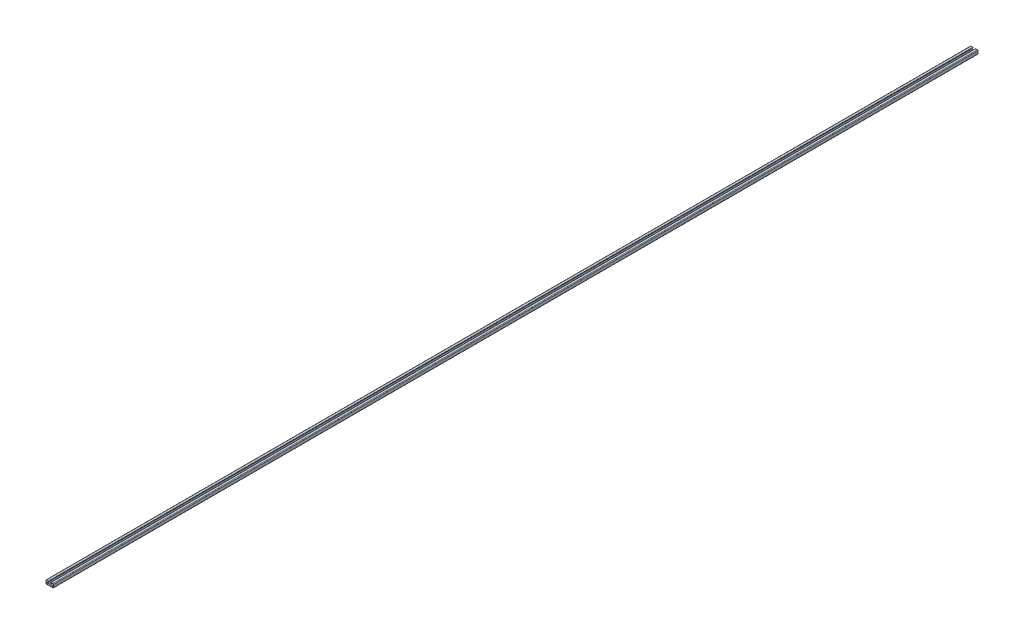
from build123d import *

# Parameters (mm, degrees)
SKETCH1_R           = 2
BOSS_EXTRUDE2_DEPTH = 3048
FILLET1_R           = 1.065
FILLET4_R           = 2.13
FILLET5_R           = 2.13
FILLET8_R           = 0.5325
FILLET11_R          = 0.5325
FILLET15_R          = 3
FILLET16_R          = 3


with BuildPart() as part:
    # Sketch1 → Boss-Extrude2 (new body)
    with BuildSketch(Plane.XY):
        Polygon((7.345, 3.97), (3.25, -1.87), (-3.25, -1.87), (-7.345, 3.97), (-3.25, 3.97), (-3.25, 6.25), (-12.5, 6.25), (-12.5, -6.25), (12.5, -6.25), (12.5, 6.25), (3.25, 6.25), (3.25, 3.97), align=None)
        with Locations((-8.5, -2.25)):
            Circle(SKETCH1_R, mode=Mode.SUBTRACT)
        with Locations((8.5, -2.25)):
            Circle(SKETCH1_R, mode=Mode.SUBTRACT)
    extrude(amount=BOSS_EXTRUDE2_DEPTH)

    # Fillet1
    fillet1_edges = [part.edges().sort_by_distance(p)[0] for p in [
        (3.25, 3.97, 1524),
        (3.25, 6.25, 1524),
        (-3.25, 6.25, 1524),
        (-3.25, 3.97, 1524),
    ]]
    fillet(fillet1_edges, radius=FILLET1_R)

    # Fillet4
    fillet4_edges = [part.edges().sort_by_distance(p)[0] for p in [
        (12.5, 6.25, 1524),
    ]]
    fillet(fillet4_edges, radius=FILLET4_R)

    # Fillet5
    fillet5_edges = [part.edges().sort_by_distance(p)[0] for p in [
        (12.5, -6.25, 1524),
        (-12.5, -6.25, 1524),
        (-12.5, 6.25, 1524),
    ]]
    fillet(fillet5_edges, radius=FILLET5_R)

    # Fillet8
    fillet8_edges = [part.edges().sort_by_distance(p)[0] for p in [
        (7.345, 3.97, 1524),
    ]]
    fillet(fillet8_edges, radius=FILLET8_R)

    # Fillet11
    fillet11_edges = [part.edges().sort_by_distance(p)[0] for p in [
        (-7.345, 3.97, 1524),
    ]]
    fillet(fillet11_edges, radius=FILLET11_R)

    # Fillet15
    fillet15_edges = [part.edges().sort_by_distance(p)[0] for p in [
        (-3.25, -1.87, 1524),
    ]]
    fillet(fillet15_edges, radius=FILLET15_R)

    # Fillet16
    fillet16_edges = [part.edges().sort_by_distance(p)[0] for p in [
        (3.25, -1.87, 1524),
    ]]
    fillet(fillet16_edges, radius=FILLET16_R)


solid = part.part
